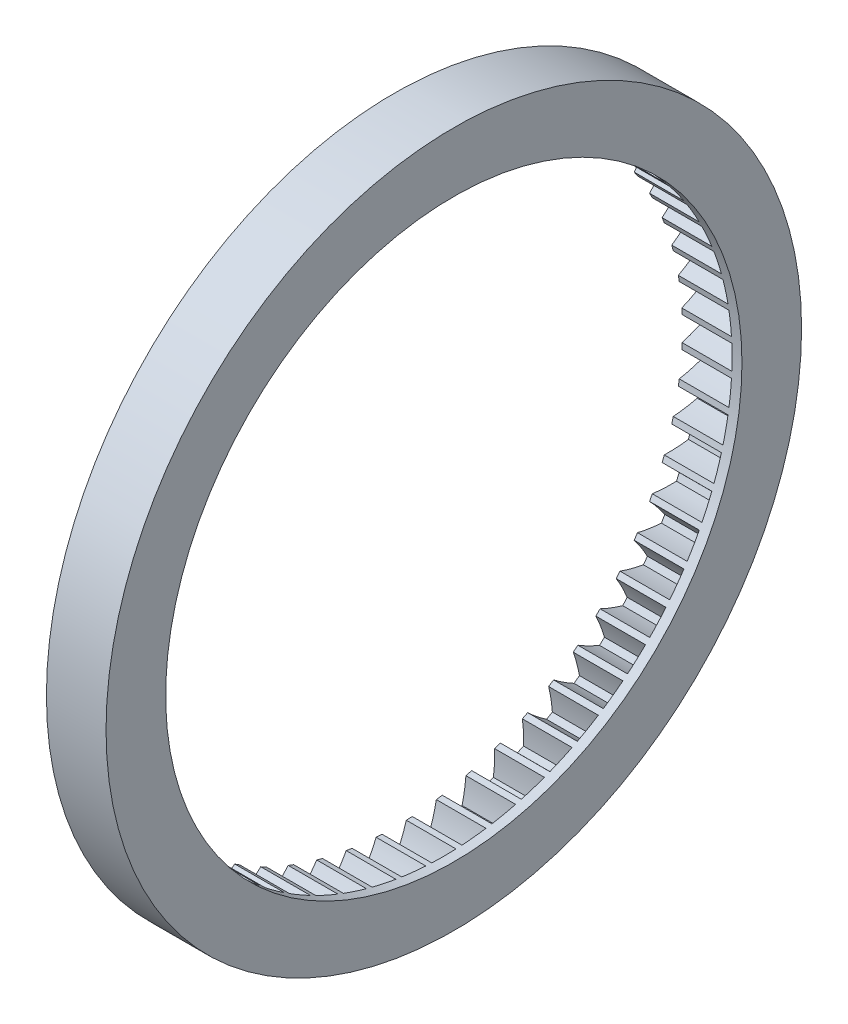
from build123d import *

# Parameters (mm, degrees)
BASPROSKE_W             = 5
BASPROSKE_H             = 6
TOOTHCUT_DEPTH          = 50.749371855
TEETHCUTS_COUNT         = 60
TEETHCUTS_ANGLE         = 354
CROQUIS1_R              = 35
CROQUIS1_R_2            = 29
SALIENTE_EXTRUIR1_DEPTH = 1


with BuildPart() as part:
    # BasProSke → Base-Revolve (revolve)
    with BuildSketch(Plane(origin=(0, 0, 0), x_dir=(1, 0, 0), z_dir=(0, 1, 0)), mode=Mode.PRIVATE) as base_revolve_sk:
        with Locations((2.5, 32)):
            Rectangle(BASPROSKE_W, BASPROSKE_H)
    revolve(base_revolve_sk.sketch.rotate(Axis((-10, 0, 0), (1, 0, 0)), 180), axis=Axis((-10, 0, 0), (1, 0, 0)))

    # TooCutSke → ToothCut (cut, through all)
    with BuildSketch(Plane(origin=(0, 0, 0), x_dir=(0, 0, -1), z_dir=(1, 0, 0))):
        with BuildLine():
            ThreePointArc((1.227357706, 28.948593027), (0.830805794, 30.117149174), (0.339543276, 31.24915537))
            ThreePointArc((0.339543276, 31.24915537), (0, 31.251), (-0.339543276, 31.24915537))
            ThreePointArc((-0.339543276, 31.24915537), (-0.830805794, 30.117149174), (-1.227357706, 28.948593027))
            ThreePointArc((-1.227357706, 28.948593027), (0, 28.9746), (1.227357706, 28.948593027))
        make_face()
    toothcut = extrude(amount=TOOTHCUT_DEPTH, mode=Mode.SUBTRACT)

    # TeethCuts: ToothCut ×60 about axis
    teethcuts_axis = Axis((-10, 0, 0), (1, 0, 0))
    for i in range(1, TEETHCUTS_COUNT):
        add(toothcut.rotate(teethcuts_axis, i * TEETHCUTS_ANGLE / (TEETHCUTS_COUNT - 1)), mode=Mode.SUBTRACT)

    # Croquis1 → Saliente-Extruir1 (add)
    with BuildSketch(Plane(origin=(5, 0, 0), x_dir=(0, 0, -1), z_dir=(1, 0, 0))):
        with Locations(Location((0, 0, 0), (0, 0, 180))):
            Circle(CROQUIS1_R)
        with Locations(Location((0, 0, 0), (0, 0, 177.589384652))):
            Circle(CROQUIS1_R_2, mode=Mode.SUBTRACT)
    extrude(amount=SALIENTE_EXTRUIR1_DEPTH)


solid = part.part
